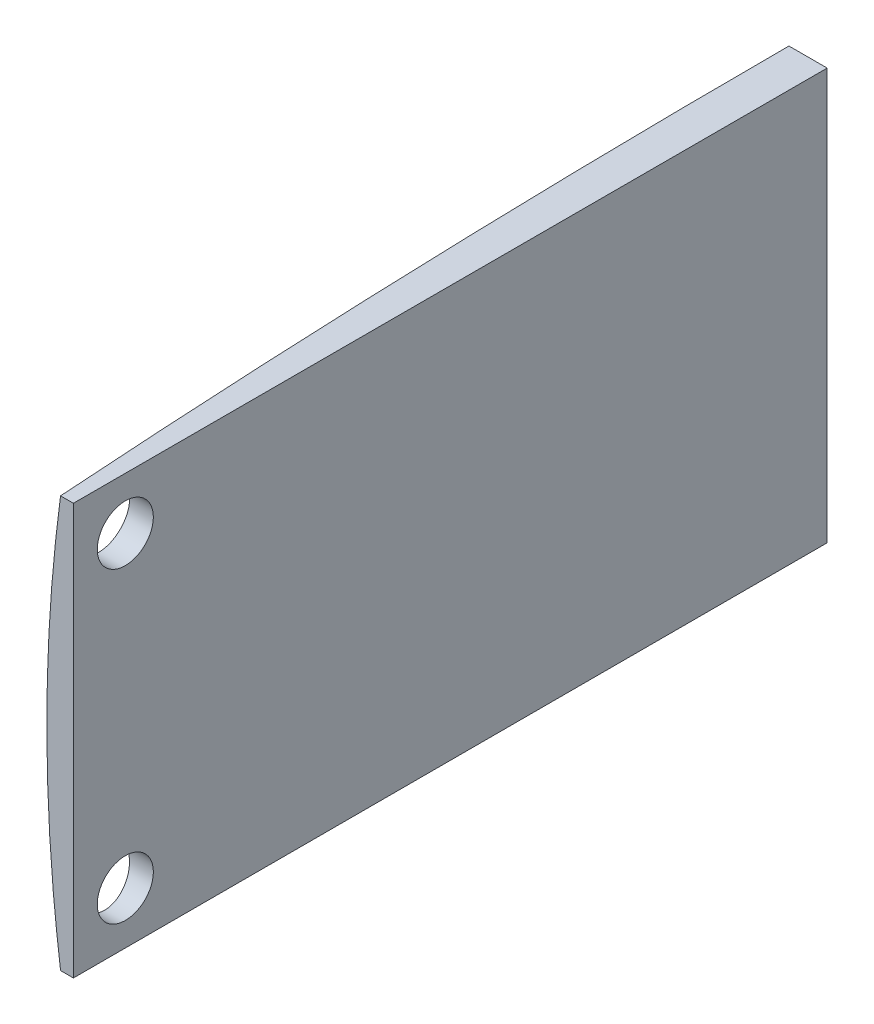
from build123d import *

# Parameters (mm, degrees)
CUT_EXTRUDE2_DEPTH      = 3112.786644088
CUT_EXTRUDE2_DEPTH_BACK = 3112.786644088
SKETCH2_OUTSIDE_W       = 3550.624
SKETCH2_OUTSIDE_H       = 1823.424
SKETCH2_OUTSIDE_W_2     = 184.404
SKETCH2_OUTSIDE_H_2     = 50.292
CUT_EXTRUDE3_START      = 6.35
SKETCH3_W               = 184.404
SKETCH3_H               = 50.292
CUT_EXTRUDE3_DEPTH      = 2742.052714982
SKETCH4_R               = 3.429
CUT_EXTRUDE4_DEPTH      = 96.78023097
SKETCH5_W               = 69.135430889
SKETCH5_H               = 107.37234518
CUT_EXTRUDE5_DEPTH      = 96.78023097


with BuildPart() as part:
    # Sketch1 → Revolve1 (revolve)
    with BuildSketch(Plane.XY):
        with BuildLine():
            Line((1372.87, -509.27), (1372.87, 509.27))
            add(Edge.make_bspline(
                [(1372.87, 509.27), (0, 509.27), (0, 0), (0, -509.27), (1372.87, -509.27)],
                knots=[4.71238898, 4.71238898, 4.71238898, 6.283185307, 6.283185307, 7.853981634, 7.853981634, 7.853981634], degree=2, weights=[1, 0.707106781, 1, 0.707106781, 1]))
        make_face()
    revolve(axis=Axis((1372.87, -509.27, 0), (0, 1, 0)))

    # Sketch2 outside → Cut-Extrude2 (cut, two sides: drawn at the far end of the back side and taken through both)
    with BuildSketch(Plane(origin=(0, 0, 0), x_dir=(0, 0, -1), z_dir=(1, 0, 0)).offset(-CUT_EXTRUDE2_DEPTH_BACK)):
        Rectangle(SKETCH2_OUTSIDE_W, SKETCH2_OUTSIDE_H)
        Rectangle(SKETCH2_OUTSIDE_W_2, SKETCH2_OUTSIDE_H_2, mode=Mode.SUBTRACT)
    extrude(amount=CUT_EXTRUDE2_DEPTH + CUT_EXTRUDE2_DEPTH_BACK, mode=Mode.SUBTRACT)

    # Sketch3 → Cut-Extrude3 (cut, through all)
    with BuildSketch(Plane(origin=(0, 0, 0), x_dir=(0, 0, -1), z_dir=(1, 0, 0)).offset(CUT_EXTRUDE3_START)):
        Rectangle(SKETCH3_W, SKETCH3_H)
    extrude(amount=CUT_EXTRUDE3_DEPTH, mode=Mode.SUBTRACT)

    # Sketch4 → Cut-Extrude4 (cut, through all)
    with BuildSketch(Plane(origin=(6.35, 0, 0), x_dir=(0, 0, -1), z_dir=(1, 0, 0))):
        with Locations((-85.852, 18.796)):
            Circle(SKETCH4_R)
        with Locations((-85.852, -18.796)):
            Circle(SKETCH4_R)
        with Locations((85.852, -18.796)):
            Circle(SKETCH4_R)
        with Locations((85.852, 18.796)):
            Circle(SKETCH4_R)
    extrude(amount=-CUT_EXTRUDE4_DEPTH, mode=Mode.SUBTRACT)

    # Sketch5 → Cut-Extrude5 (cut, through all)
    with BuildSketch(Plane.XY):
        with Locations((-10.995451772, -25.072858782)):
            Rectangle(SKETCH5_W, SKETCH5_H)
    extrude(amount=-CUT_EXTRUDE5_DEPTH, mode=Mode.SUBTRACT)


solid = part.part
